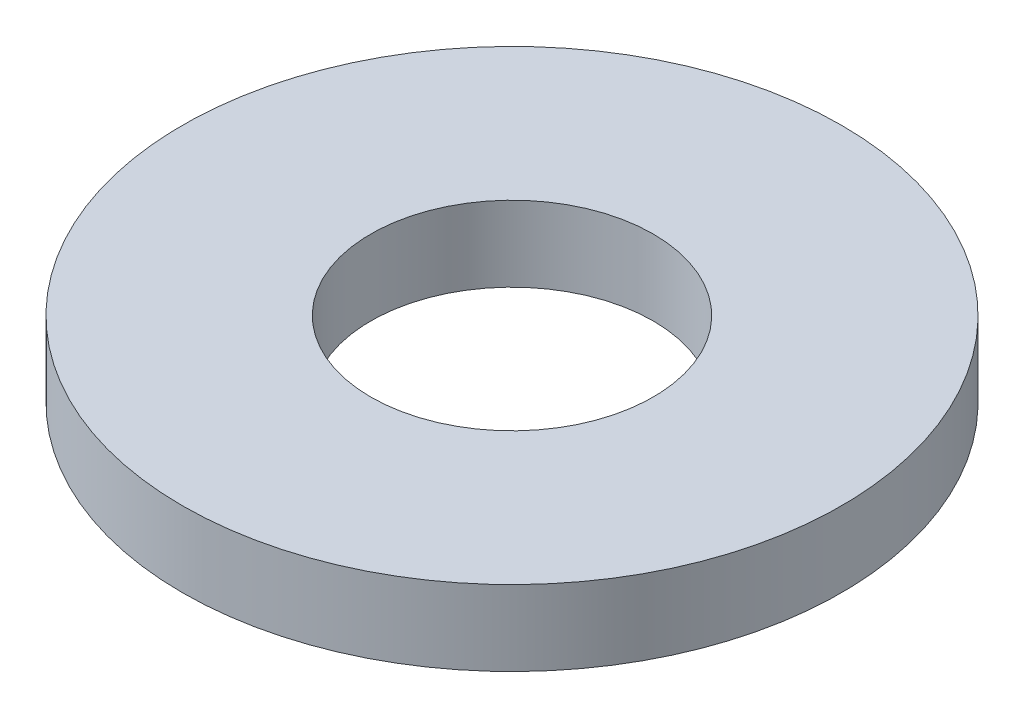
from build123d import *

# Parameters (mm, degrees)
SKETCH_1_R      = 3.5
SKETCH_1_R_2    = 1.5
EXTRUDE_1_DEPTH = 0.8


with BuildPart() as part:
    # 草图1 → 凸台-拉伸1 (new body)
    with BuildSketch(Plane(origin=(0, 0, 0), x_dir=(1, 0, 0), z_dir=(0, 1, 0))):
        with Locations(Location((0, 0, 0), (0, 0, 270))):
            Circle(SKETCH_1_R)
        with Locations(Location((0, 0, 0), (0, 0, 270))):
            Circle(SKETCH_1_R_2, mode=Mode.SUBTRACT)
    extrude(amount=EXTRUDE_1_DEPTH)


solid = part.part
